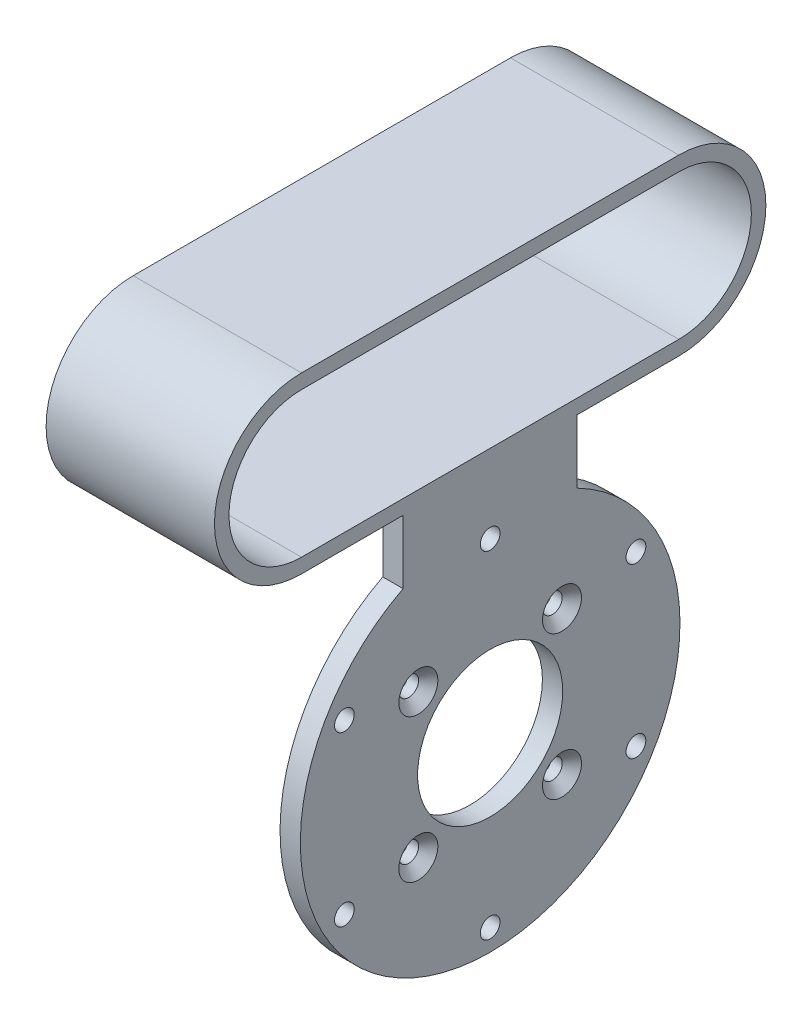
from build123d import *

# Parameters (mm, degrees)
CROQUIS1_R                                           = 12.5
SALIENTE_EXTRUIR1_DEPTH                              = 3.5
TALADRO_DE_MARGEN_PARA_M31_D                         = 3.4
REFRENTADO_PARA_TORNILLO_TAP_N_CON_CABEZ_D           = 3.4
REFRENTADO_PARA_TORNILLO_TAP_N_CON_CABEZ_CSINK_D     = 6.72
REFRENTADO_PARA_TORNILLO_TAP_N_CON_CABEZ_CSINK_ANGLE = 90
SALIENTE_EXTRUIR2_START                              = -29
SALIENTE_EXTRUIR2_DEPTH                              = 29
SALIENTE_EXTRUIR3_DEPTH                              = 3.5
REFRENTADO_PARA_TORNILLO_CON_CABEZA_TRON_D           = 3.4
REFRENTADO_PARA_TORNILLO_CON_CABEZA_TRON_CBORE_D     = 7
REFRENTADO_PARA_TORNILLO_CON_CABEZA_TRON_CBORE_DEPTH = 2.4


with BuildPart() as part:
    # Croquis1 → Saliente-Extruir1 (new body)
    with BuildSketch(Plane(origin=(0, 0, 0), x_dir=(0, 0, -1), z_dir=(1, 0, 0))):
        with BuildLine():
            Line((-15, 40), (-15, 29.05666877))
            ThreePointArc((-15, 29.05666877), (0, -32.7), (15, 29.05666877))
            Line((15, 29.05666877), (15, 40))
            Line((15, 40), (32.5, 40))
            ThreePointArc((32.5, 40), (47.5, 55), (32.5, 70))
            Line((32.5, 70), (-32.5, 70))
            ThreePointArc((-32.5, 70), (-47.5, 55), (-32.5, 40))
            Line((-32.5, 40), (-15, 40))
        make_face()
        Circle(CROQUIS1_R, mode=Mode.SUBTRACT)
        with BuildLine():
            Line((-32.5, 67.5), (32.5, 67.5))
            ThreePointArc((32.5, 67.5), (45, 55), (32.5, 42.5))
            Line((32.5, 42.5), (-32.5, 42.5))
            ThreePointArc((-32.5, 42.5), (-45, 55), (-32.5, 67.5))
        make_face(mode=Mode.SUBTRACT)
    extrude(amount=SALIENTE_EXTRUIR1_DEPTH)

    # Taladro de margen para M31 (through all)
    with Locations(Plane(origin=(3.5, 0, 0), x_dir=(0, 0, -1), z_dir=(1, 0, 0))):
        with Locations((0, 29), (25.11473671, 14.5), (25.11473671, -14.5), (0, -29), (-25.11473671, -14.5), (-25.11473671, 14.5)):
            Hole(TALADRO_DE_MARGEN_PARA_M31_D / 2)

    # Refrentado para tornillo tapón con cabeza plana de clavija de M31 (through all)
    with Locations(Plane(origin=(3.5, 0, 0), x_dir=(0, 0, -1), z_dir=(1, 0, 0))):
        with Locations((12.374368671, 12.374368671), (-12.374368671, -12.374368671), (-12.374368671, 12.374368671), (12.374368671, -12.374368671)):
            CounterSinkHole(REFRENTADO_PARA_TORNILLO_TAP_N_CON_CABEZ_D / 2, REFRENTADO_PARA_TORNILLO_TAP_N_CON_CABEZ_CSINK_D / 2, counter_sink_angle=REFRENTADO_PARA_TORNILLO_TAP_N_CON_CABEZ_CSINK_ANGLE)

    # Croquis8 → Saliente-Extruir2 (add)
    with BuildSketch(Plane(origin=(3.5, 0, 0), x_dir=(0, 0, -1), z_dir=(1, 0, 0)).offset(SALIENTE_EXTRUIR2_START)):
        with BuildLine():
            Line((15, 40), (32.5, 40))
            ThreePointArc((32.5, 40), (47.5, 55), (32.5, 70))
            Line((32.5, 70), (-32.5, 70))
            ThreePointArc((-32.5, 70), (-47.5, 55), (-32.5, 40))
            Line((-32.5, 40), (-15, 40))
            Line((-15, 40), (15, 40))
        make_face()
        with BuildLine():
            Line((-32.5, 67.5), (32.5, 67.5))
            ThreePointArc((32.5, 67.5), (45, 55), (32.5, 42.5))
            Line((32.5, 42.5), (-32.5, 42.5))
            ThreePointArc((-32.5, 42.5), (-45, 55), (-32.5, 67.5))
        make_face(mode=Mode.SUBTRACT)
    extrude(amount=SALIENTE_EXTRUIR2_DEPTH)

    # Croquis12 → Saliente-Extruir3 (add)
    with BuildSketch(Plane.ZY.offset(25.5)):
        with BuildLine():
            Line((32.5, 42.5), (-32.5, 42.5))
            ThreePointArc((-32.5, 42.5), (-45, 55), (-32.5, 67.5))
            Line((-32.5, 67.5), (32.5, 67.5))
            ThreePointArc((32.5, 67.5), (45, 55), (32.5, 42.5))
        make_face()
    extrude(amount=-SALIENTE_EXTRUIR3_DEPTH)

    # Refrentado para tornillo con cabeza troncocónica de M31 (through all)
    with Locations(Plane.ZY.offset(25.5)):
        with Locations((-22.5, 55), (22.5, 55)):
            CounterBoreHole(REFRENTADO_PARA_TORNILLO_CON_CABEZA_TRON_D / 2, REFRENTADO_PARA_TORNILLO_CON_CABEZA_TRON_CBORE_D / 2, REFRENTADO_PARA_TORNILLO_CON_CABEZA_TRON_CBORE_DEPTH)


solid = part.part
